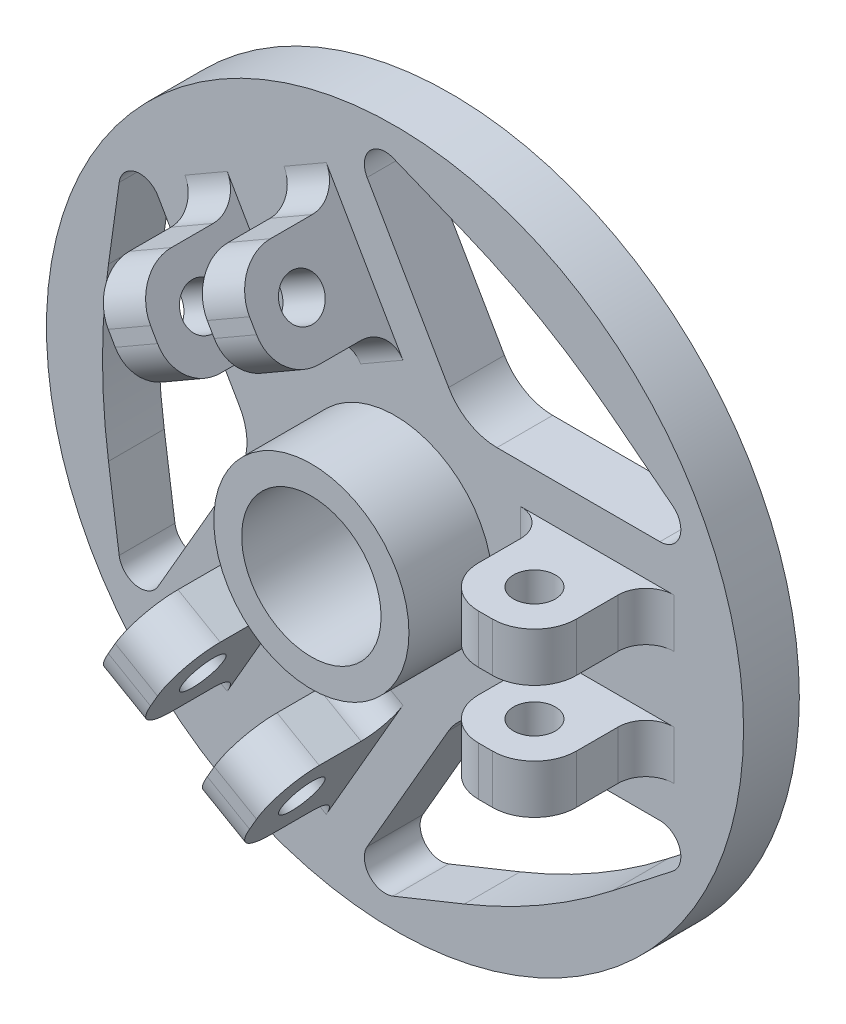
from build123d import *

# Parameters (mm, degrees)
SKETCH1_R                = 25
BOSS_EXTRUDE1_DEPTH      = 4
SKETCH2_R                = 5
CUT_EXTRUDE1_DEPTH       = 36.580893749
SKETCH3_W                = 7
SKETCH3_H                = 3.5
BOSS_EXTRUDE2_DEPTH      = 8
FILLET1_R                = 3
SKETCH4_R                = 1.5
CUT_EXTRUDE2_DEPTH       = 42.481592303
FILLET2_R                = 2
CIRPATTERN1_COUNT        = 3
FILLET1_OF_CIRPATTERN1_R = 3
FILLET2_OF_CIRPATTERN1_R = 2
BOSS_EXTRUDE3_START      = 6
SKETCH5_R                = 7
SKETCH5_R_2              = 5
BOSS_EXTRUDE3_DEPTH      = 6
CUT_EXTRUDE3_DEPTH       = 37.249137921
FILLET3_R                = 4
FILLET4_R                = 44
CIRPATTERN2_COUNT        = 3
FILLET3_OF_CIRPATTERN2_R = 4
FILLET4_OF_CIRPATTERN2_R = 44


with BuildPart() as part:
    # Sketch1 → Boss-Extrude1 (new body)
    with BuildSketch(Plane.XY):
        Circle(SKETCH1_R)
    extrude(amount=BOSS_EXTRUDE1_DEPTH)

    # Sketch2 → Cut-Extrude1 (cut, through all)
    with BuildSketch(Plane.XY.offset(4)):
        Circle(SKETCH2_R)
    extrude(amount=-CUT_EXTRUDE1_DEPTH, mode=Mode.SUBTRACT)

    # Sketch3 → Boss-Extrude2 (add)
    with BuildSketch(Plane.XY.offset(4)):
        with Locations((14.5, -4.1)):
            Rectangle(SKETCH3_W, SKETCH3_H)
        with Locations((14.5, 4.1)):
            Rectangle(SKETCH3_W, SKETCH3_H)
    boss_extrude2 = extrude(amount=BOSS_EXTRUDE2_DEPTH)

    # Fillet1
    fillet1_edges = [part.edges().sort_by_distance(p)[0] for p in [
        (11, 4.1, 12),
        (18, 4.1, 12),
        (11, -4.1, 12),
        (18, -4.1, 12),
    ]]
    fillet(fillet1_edges, radius=FILLET1_R)

    # Sketch4 → Cut-Extrude2 (cut, through all)
    with BuildSketch(Plane(origin=(0, 5.85, 0), x_dir=(1, 0, 0), z_dir=(0, 1, 0))):
        with Locations(Location((14.5, -8.5, 0), (0, 0, 270))):
            Circle(SKETCH4_R)
    cut_extrude2 = extrude(amount=-CUT_EXTRUDE2_DEPTH, mode=Mode.SUBTRACT)

    # Fillet2
    fillet2_edges = [part.edges().sort_by_distance(p)[0] for p in [
        (11, 4.1, 4),
        (18, 4.1, 4),
        (11, -4.1, 4),
        (18, -4.1, 4),
    ]]
    fillet(fillet2_edges, radius=FILLET2_R)

    # CirPattern1: Boss-Extrude2, Cut-Extrude2 ×3 about axis
    cirpattern1_axis = Axis((0, 0, 0), (0, 0, 1))
    add([boss_extrude2.rotate(cirpattern1_axis, i * 360 / CIRPATTERN1_COUNT) for i in range(1, CIRPATTERN1_COUNT)])
    add([cut_extrude2.rotate(cirpattern1_axis, i * 360 / CIRPATTERN1_COUNT) for i in range(1, CIRPATTERN1_COUNT)], mode=Mode.SUBTRACT)

    # Fillet1 of CirPattern1
    fillet1_of_cirpattern1_edges = [part.edges().sort_by_distance(p)[0] for p in [
        (-9.050704156, 7.476279442, 12),
        (-12.550704156, 13.538457268, 12),
        (-1.949295844, 11.576279442, 12),
        (-5.449295844, 17.638457268, 12),
        (-1.949295844, -11.576279442, 12),
        (-5.449295844, -17.638457268, 12),
        (-9.050704156, -7.476279442, 12),
        (-12.550704156, -13.538457268, 12),
    ]]
    fillet(fillet1_of_cirpattern1_edges, radius=FILLET1_OF_CIRPATTERN1_R)

    # Fillet2 of CirPattern1
    fillet2_of_cirpattern1_edges = [part.edges().sort_by_distance(p)[0] for p in [
        (-9.050704156, 7.476279442, 4),
        (-12.550704156, 13.538457268, 4),
        (-1.949295844, 11.576279442, 4),
        (-5.449295844, 17.638457268, 4),
        (-1.949295844, -11.576279442, 4),
        (-5.449295844, -17.638457268, 4),
        (-9.050704156, -7.476279442, 4),
        (-12.550704156, -13.538457268, 4),
    ]]
    fillet(fillet2_of_cirpattern1_edges, radius=FILLET2_OF_CIRPATTERN1_R)

    # Sketch5 → Boss-Extrude3 (add)
    with BuildSketch(Plane.XY.offset(4).offset(BOSS_EXTRUDE3_START)):
        Circle(SKETCH5_R)
        Circle(SKETCH5_R_2, mode=Mode.SUBTRACT)
    extrude(amount=-BOSS_EXTRUDE3_DEPTH)

    # Sketch6 → Cut-Extrude3 (cut, through all)
    with BuildSketch(Plane.XY.offset(4)):
        with BuildLine():
            Line((5, 8.660254038), (-2, 20.784609691))
            ThreePointArc((-2, 20.784609691), (-1.833026265, 22.518698234), (-0.139052004, 22.925385473))
            Line((-0.139052004, 22.925385473), (10.706170451, 18.543631176))
            Line((10.706170451, 18.543631176), (19.923492213, 11.342270168))
            ThreePointArc((19.923492213, 11.342270168), (20.418277863, 9.671901806), (19, 8.660254038))
            Line((19, 8.660254038), (5, 8.660254038))
        make_face()
    cut_extrude3 = extrude(amount=-CUT_EXTRUDE3_DEPTH, mode=Mode.SUBTRACT)

    # Fillet3
    fillet3_edges = [part.edges().sort_by_distance(p)[0] for p in [
        (5, 8.660254038, 2),
    ]]
    fillet(fillet3_edges, radius=FILLET3_R)

    # Fillet4
    fillet4_edges = [part.edges().sort_by_distance(p)[0] for p in [
        (10.706170451, 18.543631176, 2),
    ]]
    fillet(fillet4_edges, radius=FILLET4_R)

    # CirPattern2: Cut-Extrude3 ×3 about axis
    cirpattern2_axis = Axis((0, 0, 0), (0, 0, 1))
    for i in range(1, CIRPATTERN2_COUNT):
        add(cut_extrude3.rotate(cirpattern2_axis, i * 360 / CIRPATTERN2_COUNT), mode=Mode.SUBTRACT)

    # Fillet3 of CirPattern2
    fillet3_of_cirpattern2_edges = [part.edges().sort_by_distance(p)[0] for p in [
        (-10, 0, 2),
        (5, -8.660254038, 2),
    ]]
    fillet(fillet3_of_cirpattern2_edges, radius=FILLET3_OF_CIRPATTERN2_R)

    # Fillet4 of CirPattern2
    fillet4_of_cirpattern2_edges = [part.edges().sort_by_distance(p)[0] for p in [
        (-21.412340902, 0, 2),
        (10.706170451, -18.543631176, 2),
    ]]
    fillet(fillet4_of_cirpattern2_edges, radius=FILLET4_OF_CIRPATTERN2_R)


solid = part.part
